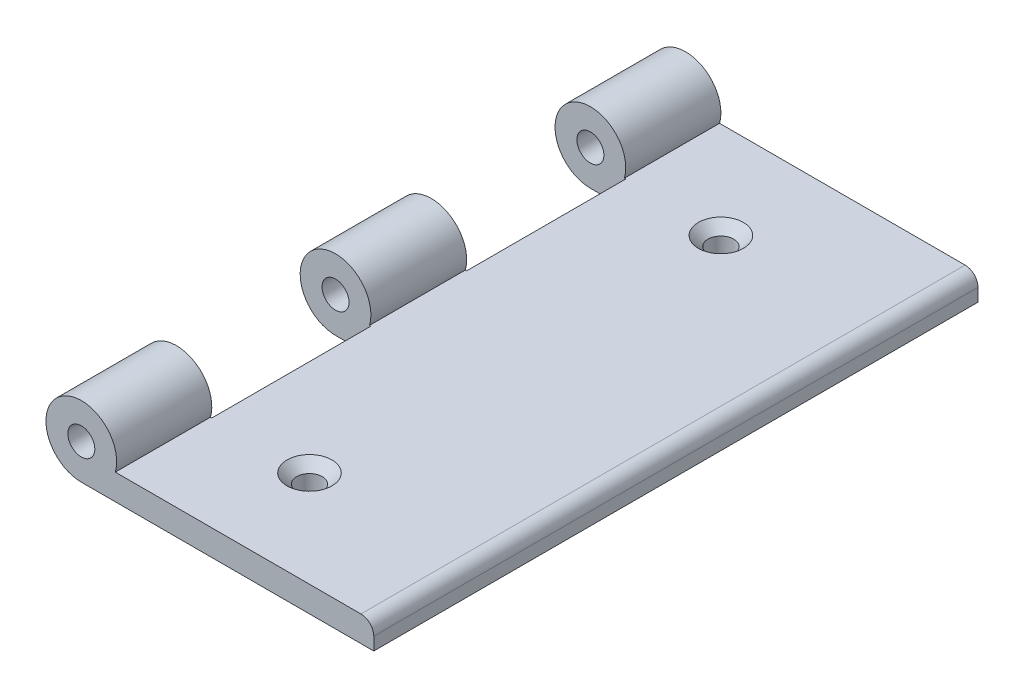
from build123d import *

# Parameters (mm, degrees)
SKETCH_1_W           = 40
SKETCH_1_H           = 94
EXTRUDE_1_DEPTH      = 4
EXTRUDE_2_DEPTH      = 47
EXTRUDE_2_DEPTH_BACK = 47
SKETCH_2_R           = 2.1
SKETCH_3_W           = 11
SKETCH_3_H           = 24.75
CUT_EXTRUDE_1_DEPTH  = 14
SKETCH_4_R           = 2
CUT_EXTRUDE_2_DEPTH  = 14
CHAMFER_2_SIZE       = 1.5
FILLET_1_R           = 2


with BuildPart() as part:
    # Эскиз1 → Бобышка-Вытянуть1 (new body)
    with BuildSketch(Plane(origin=(0, 0, 0), x_dir=(1, 0, 0), z_dir=(0, 1, 0))):
        Rectangle(SKETCH_1_W, SKETCH_1_H)
    extrude(amount=EXTRUDE_1_DEPTH)

    # Эскиз2 → Бобышка-Вытянуть2 (add, two sides: drawn at the far end of the back side and taken through both)
    with BuildSketch(Plane.XY.offset(-EXTRUDE_2_DEPTH_BACK)):
        with BuildLine():
            Line((-20, 0), (-25.5, 0))
            ThreePointArc((-25.5, 0), (-28.81662479, 9.887482194), (-20.208497378, 4))
            Line((-20.208497378, 4), (-20, 4))
            Line((-20, 4), (-20, 0))
        make_face()
        with Locations(Location((-25.5, 5.5, 0), (0, 0, 180))):
            Circle(SKETCH_2_R, mode=Mode.SUBTRACT)
    extrude(amount=EXTRUDE_2_DEPTH + EXTRUDE_2_DEPTH_BACK)

    # Эскиз3 → Вырез-Вытянуть1 (cut)
    with BuildSketch(Plane(origin=(0, 0, 0), x_dir=(1, 0, 0), z_dir=(0, 1, 0))):
        with Locations((-25.5, 19.825)):
            Rectangle(SKETCH_3_W, SKETCH_3_H)
        with Locations((-25.5, -19.825)):
            Rectangle(SKETCH_3_W, SKETCH_3_H)
    extrude(amount=CUT_EXTRUDE_1_DEPTH, mode=Mode.SUBTRACT)

    # Эскиз4 → Вырез-Вытянуть2 (cut)
    with BuildSketch(Plane(origin=(0, 4, 0), x_dir=(1, 0, 0), z_dir=(0, 1, 0))):
        with Locations(Location((-5, 32, 0), (0, 0, 270))):
            Circle(SKETCH_4_R)
        with Locations(Location((-5, -32, 0), (0, 0, 270))):
            Circle(SKETCH_4_R)
    extrude(amount=-CUT_EXTRUDE_2_DEPTH, mode=Mode.SUBTRACT)

    # Фаска2
    chamfer_2_edges = [part.edges().sort_by_distance(p)[0] for p in [
        (-5, 4, -34),
        (-5, 4, 30),
    ]]
    chamfer(chamfer_2_edges, length=CHAMFER_2_SIZE)

    # Скругление1
    fillet_1_edges = [part.edges().sort_by_distance(p)[0] for p in [
        (20, 4, 0),
    ]]
    fillet(fillet_1_edges, radius=FILLET_1_R)


solid = part.part
